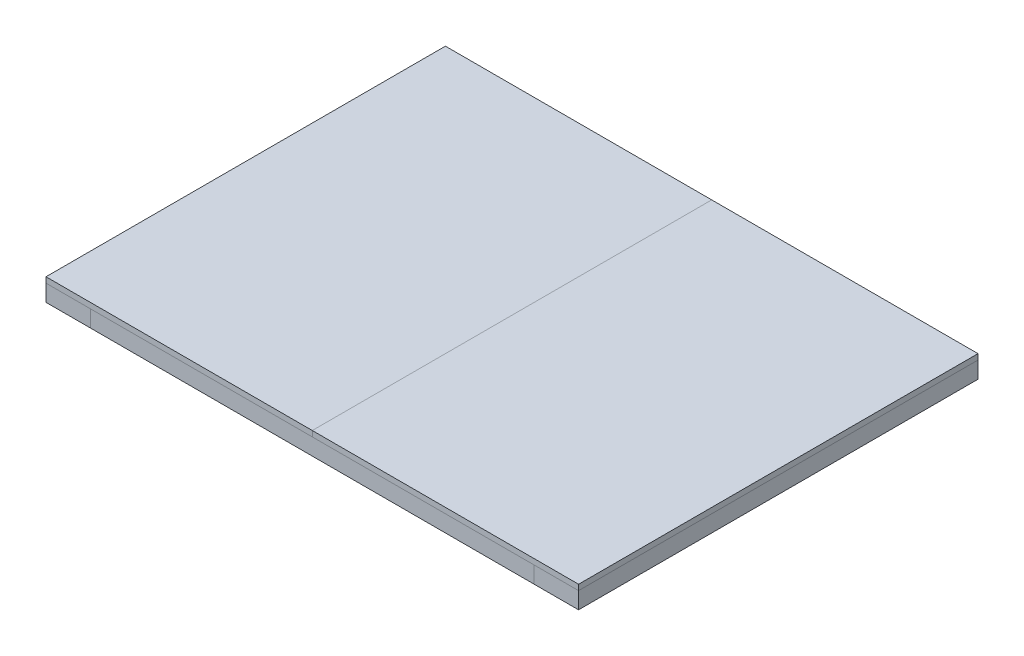
from build123d import *

# Parameters (mm, degrees)
SKETCH1_W           = 609.6
SKETCH1_H           = 914.4
BOSS_EXTRUDE1_DEPTH = 12.7
SKETCH2_W           = 609.6
SKETCH2_H           = 914.4
BOSS_EXTRUDE2_DEPTH = 12.7
SKETCH3_W           = 101.6
SKETCH3_H           = 914.4
BOSS_EXTRUDE4_DEPTH = 38.1
SKETCH5_W           = 101.6
SKETCH5_H           = 914.4
BOSS_EXTRUDE5_DEPTH = 38.1
SKETCH7_W           = 1016
SKETCH7_H           = 101.6
BOSS_EXTRUDE6_DEPTH = 38.1
SKETCH6_W           = 1016
SKETCH6_H           = 101.6
BOSS_EXTRUDE7_DEPTH = 38.1
SKETCH8_W           = 101.6
SKETCH8_H           = 711.2
BOSS_EXTRUDE8_DEPTH = 38.1


with BuildPart() as part:
    # Sketch1 → Boss-Extrude1 (new body)
    with BuildSketch(Plane(origin=(0, 0, 0), x_dir=(1, 0, 0), z_dir=(0, 1, 0))):
        with Locations((304.8, 457.2)):
            Rectangle(SKETCH1_W, SKETCH1_H)
    extrude(amount=BOSS_EXTRUDE1_DEPTH)


with BuildPart() as body_2:
    # Sketch2 → Boss-Extrude2 (new body)
    with BuildSketch(Plane(origin=(0, 0, 0), x_dir=(1, 0, 0), z_dir=(0, 1, 0))):
        with Locations((914.4, 457.2)):
            Rectangle(SKETCH2_W, SKETCH2_H)
    extrude(amount=BOSS_EXTRUDE2_DEPTH)


with BuildPart() as body_3:
    # Sketch3 → Boss-Extrude4 (new body)
    with BuildSketch(Plane(origin=(0, 0, 0), x_dir=(-1, 0, 0), z_dir=(0, -1, 0))):
        with Locations((-1168.4, 457.2)):
            Rectangle(SKETCH3_W, SKETCH3_H)
    extrude(amount=BOSS_EXTRUDE4_DEPTH)


with BuildPart() as body_4:
    # Sketch5 → Boss-Extrude5 (new body)
    with BuildSketch(Plane(origin=(0, 0, 0), x_dir=(-1, 0, 0), z_dir=(0, -1, 0))):
        with Locations((-50.8, 457.2)):
            Rectangle(SKETCH5_W, SKETCH5_H)
    extrude(amount=BOSS_EXTRUDE5_DEPTH)


with BuildPart() as body_5:
    # Sketch7 → Boss-Extrude6 (new body)
    with BuildSketch(Plane(origin=(0, 0, 0), x_dir=(-1, 0, 0), z_dir=(0, -1, 0))):
        with Locations((-609.6, 50.8)):
            Rectangle(SKETCH7_W, SKETCH7_H)
    extrude(amount=BOSS_EXTRUDE6_DEPTH)


with BuildPart() as body_6:
    # Sketch6 → Boss-Extrude7 (new body)
    with BuildSketch(Plane(origin=(0, 0, 0), x_dir=(-1, 0, 0), z_dir=(0, -1, 0))):
        with Locations((-609.6, 863.6)):
            Rectangle(SKETCH6_W, SKETCH6_H)
    extrude(amount=BOSS_EXTRUDE7_DEPTH)


with BuildPart() as body_7:
    # Sketch8 → Boss-Extrude8 (new body)
    with BuildSketch(Plane(origin=(0, 0, 0), x_dir=(-1, 0, 0), z_dir=(0, -1, 0))):
        with Locations((-609.6, 457.2)):
            Rectangle(SKETCH8_W, SKETCH8_H)
    extrude(amount=BOSS_EXTRUDE8_DEPTH)


solid = Compound([part.part, body_2.part, body_3.part, body_4.part, body_5.part, body_6.part, body_7.part])
